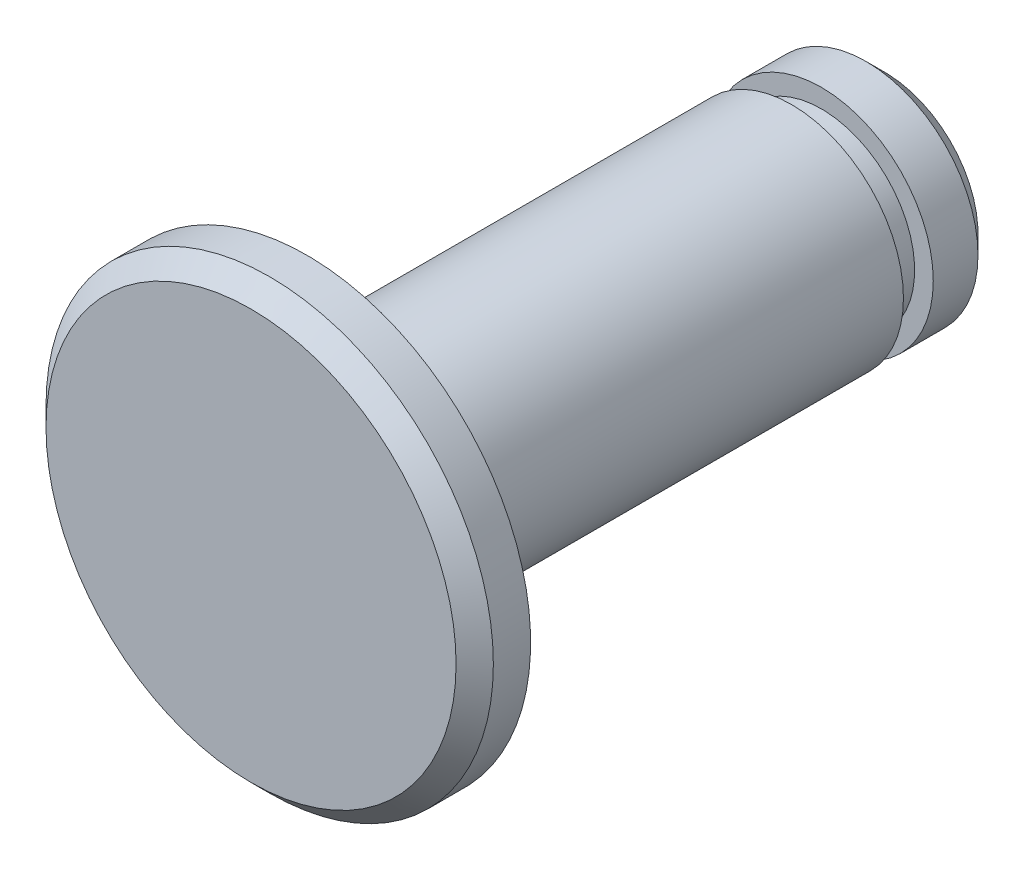
from build123d import *

# Parameters (mm, degrees)
CHAMFER1_SIZE = 0.5


with BuildPart() as part:
    # Sketch1 → Revolve1 (revolve)
    with BuildSketch(Plane(origin=(0, 0, 0), x_dir=(1, 0, 0), z_dir=(0, 1, 0))):
        Polygon((0, -22.374712644), (-6, -22.374712644), (-6, -20.874712644), (-3, -20.874712644), (-3, -7.874712644), (-2.5, -7.874712644), (-2.5, -7.074712644), (-3, -7.074712644), (-3, -5.374712644), (0, -5.374712644), align=None)
    revolve(axis=Axis((0, 0, -21.276149425), (0, 0, 1)))

    # Chamfer1
    chamfer1_edges = [part.edges().sort_by_distance(p)[0] for p in [
        (3, 0, 5.374712644),
        (6, 0, 22.374712644),
    ]]
    chamfer(chamfer1_edges, length=CHAMFER1_SIZE)


solid = part.part
